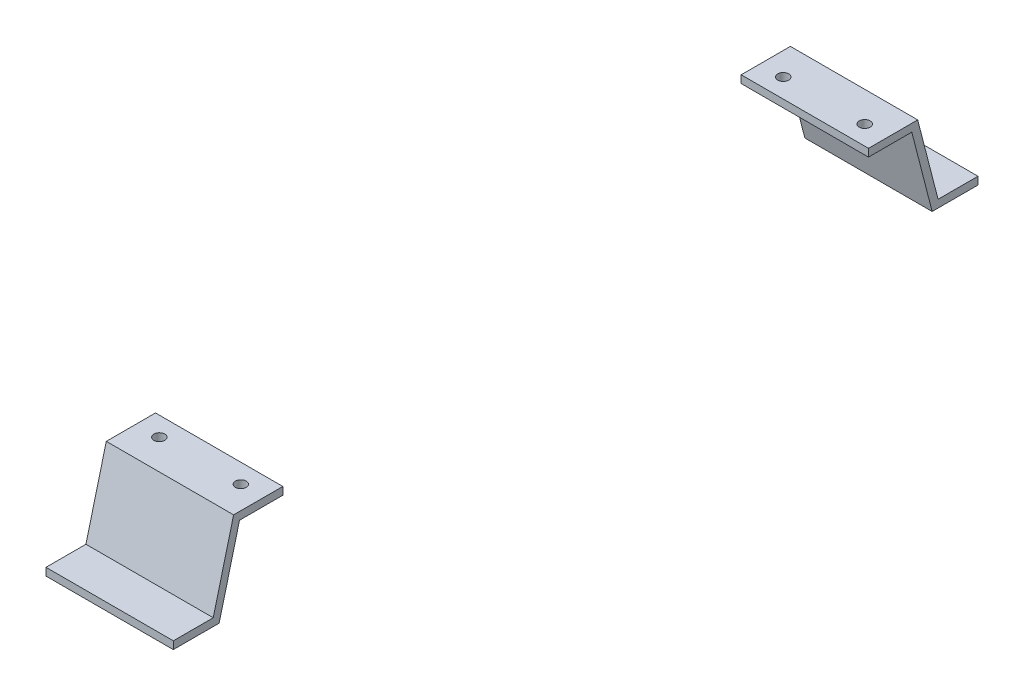
from build123d import *

# Parameters (mm, degrees)
EXTRUDE_1_DEPTH    = 25
HOLE_WIZARD_M4_2_D = 4.3


with BuildPart() as part:
    # 草图1 → 拉伸-薄壁1 (new, symmetric)
    with BuildSketch(Plane(origin=(0, 0, 0), x_dir=(0, 0, -1), z_dir=(1, 0, 0))):
        Polygon((-158, 132), (-140, 132), (-132, 163), (-115, 163), (-115, 166), (-134.324092373, 166), (-142.324092373, 135), (-158, 135), align=None)
    extrude(amount=EXTRUDE_1_DEPTH, both=True)

    # M4 间隙孔2 (through all)
    with Locations(Plane(origin=(0, 166, 0), x_dir=(1, 0, 0), z_dir=(0, 1, 0))):
        with Locations((16, -122.5), (-16, -122.5)):
            Hole(HOLE_WIZARD_M4_2_D / 2)


with BuildPart() as body_2:
    # 镜向2: mirrored copy
    add(part.part.mirror(Plane.XY))


solid = Compound([part.part, body_2.part])
